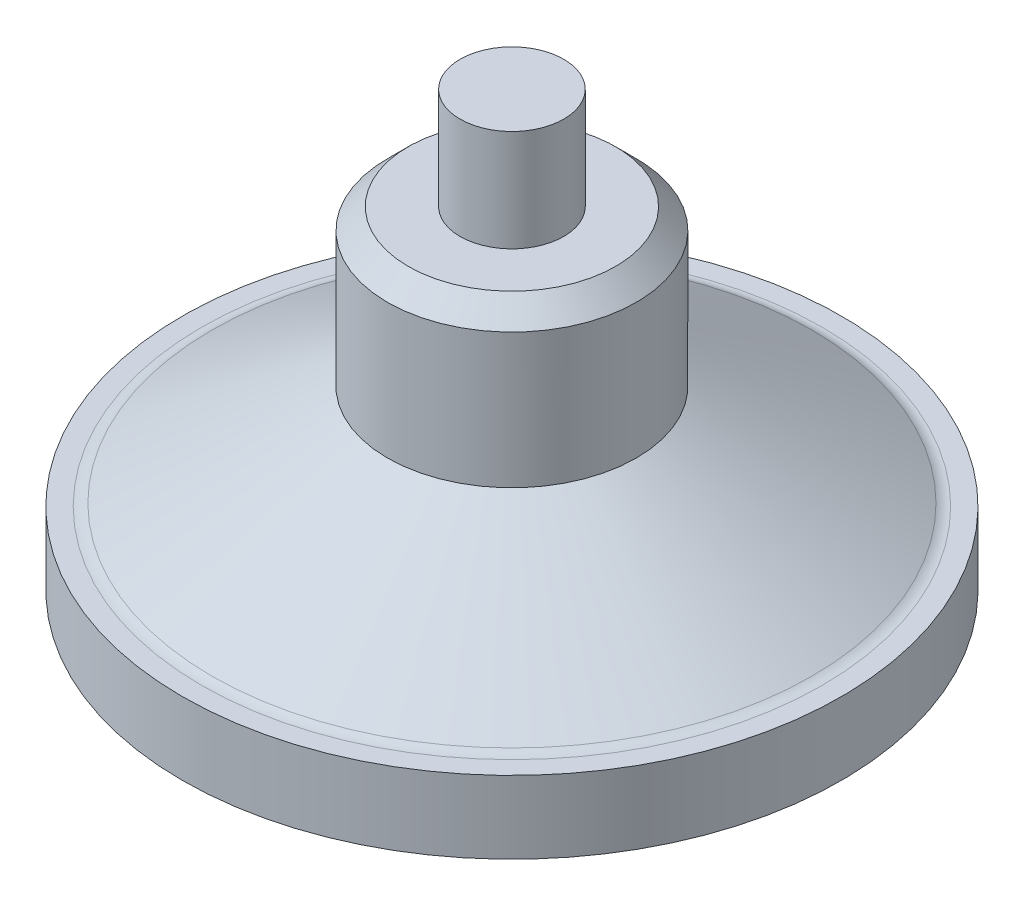
from build123d import *

# Parameters (mm, degrees)
FILLET1_R     = 3
CHAMFER1_SIZE = 1
FILLET2_R     = 1


with BuildPart() as part:
    # Sketch1 → Revolve1 (revolve)
    with BuildSketch(Plane.XY, mode=Mode.PRIVATE) as revolve1_sk:
        Polygon((6, 10.999045222), (2.5, 10.999045222), (2.5, 15.899045222), (0, 15.899045222), (0, 3.5), (0, 0), (5.062177826, 0), (13.75, -5.015916471), (15.887822174, -5.015916471), (15.887822174, -1.515916471), (14.687822174, -1.515916471), (6, 3.5), align=None)
    revolve(revolve1_sk.sketch.rotate(Axis((0, 31.975823544, 0), (0, -1, 0)), 90), axis=Axis((0, 31.975823544, 0), (0, -1, 0)))

    # Fillet1
    fillet1_edges = [part.edges().sort_by_distance(p)[0] for p in [
        (0, -5.015916471, -13.75),
    ]]
    fillet(fillet1_edges, radius=FILLET1_R)

    # Chamfer1
    chamfer1_edges = [part.edges().sort_by_distance(p)[0] for p in [
        (0, 10.999045222, -6),
    ]]
    chamfer(chamfer1_edges, length=CHAMFER1_SIZE)

    # Fillet2
    fillet2_edges = [part.edges().sort_by_distance(p)[0] for p in [
        (0, -1.515916471, -14.687822174),
    ]]
    fillet(fillet2_edges, radius=FILLET2_R)


solid = part.part
